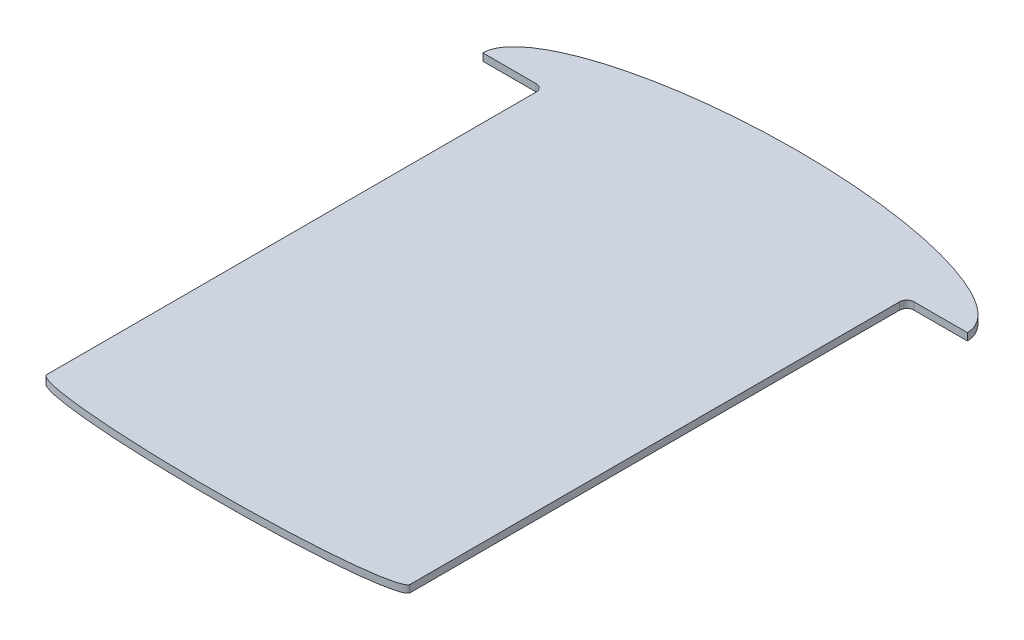
from build123d import *

# Parameters (mm, degrees)
BOSS_EXTRUDE1_DEPTH = 3
FILLET1_R           = 3


with BuildPart() as part:
    # Sketch1 → Boss-Extrude1 (new body)
    with BuildSketch(Plane(origin=(0, 0, 0), x_dir=(1, 0, 0), z_dir=(0, 1, 0))):
        with BuildLine():
            Line((-100, 95), (-75, 95))
            Line((-75, 95), (-75, -110))
            add(Edge.make_bspline(
                [(-75, -110), (-75, -117.010969017), (0, -117.010969017), (75, -117.010969017), (75, -110)],
                knots=[3.154436585, 3.154436585, 3.154436585, 4.71238898, 4.71238898, 6.270341376, 6.270341376, 6.270341376], degree=2, weights=[0.948616907, 0.688700554, 1, 0.688700554, 0.948616907]))
            Line((75, -110), (75, 95))
            Line((75, 95), (100, 95))
            add(Edge.make_bspline(
                [(100, 95), (100, 125), (0, 125), (-100, 125), (-100, 95)],
                knots=[0, 0, 0, 1.570796327, 1.570796327, 3.141592654, 3.141592654, 3.141592654], degree=2, weights=[1, 0.707106781, 1, 0.707106781, 1]))
        make_face()
    extrude(amount=BOSS_EXTRUDE1_DEPTH)

    # Fillet1
    fillet1_edges = [part.edges().sort_by_distance(p)[0] for p in [
        (-75, 1.5, -95),
        (75, 1.5, -95),
    ]]
    fillet(fillet1_edges, radius=FILLET1_R)


solid = part.part
